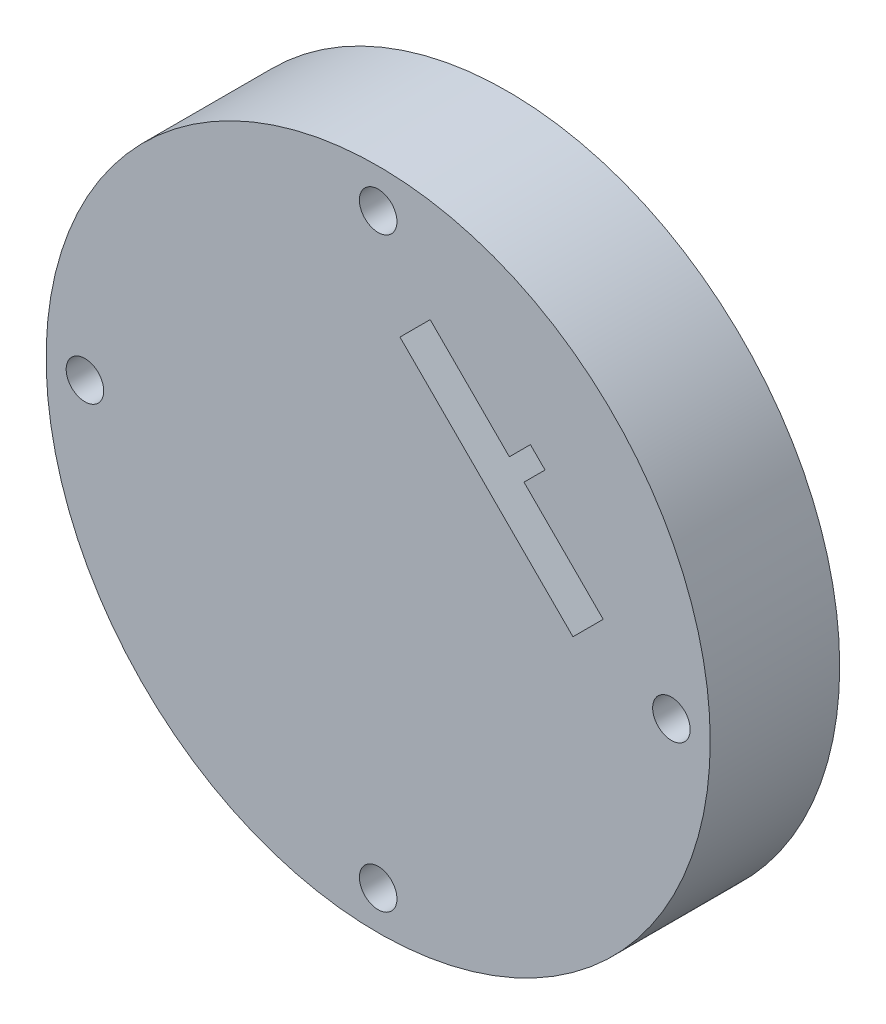
from build123d import *

# Parameters (mm, degrees)
SKETCH1_R           = 25.65
SKETCH1_R_2         = 1.45
BOSS_EXTRUDE1_DEPTH = 10
CUT_EXTRUDE1_DEPTH  = 7.5


with BuildPart() as part:
    # Sketch1 → Boss-Extrude1 (new body)
    with BuildSketch(Plane.XY):
        Circle(SKETCH1_R)
        with Locations((0, -22.65)):
            Circle(SKETCH1_R_2, mode=Mode.SUBTRACT)
        with Locations((22.65, 0)):
            Circle(SKETCH1_R_2, mode=Mode.SUBTRACT)
        with Locations((0, 22.65)):
            Circle(SKETCH1_R_2, mode=Mode.SUBTRACT)
        with Locations((-22.65, 0)):
            Circle(SKETCH1_R_2, mode=Mode.SUBTRACT)
    extrude(amount=BOSS_EXTRUDE1_DEPTH)

    # Sketch2 → Cut-Extrude1 (cut)
    with BuildSketch(Plane.XY.offset(10)):
        Polygon((1.682914139, 15.047232304), (15.047232304, 1.682914139), (17.380684682, 4.016366517), (11.264211024, 10.132840174), (12.890556621, 11.759185771), (11.759185771, 12.890556621), (10.132840174, 11.264211024), (4.016366517, 17.380684682), align=None)
    extrude(amount=-CUT_EXTRUDE1_DEPTH, mode=Mode.SUBTRACT)


solid = part.part
